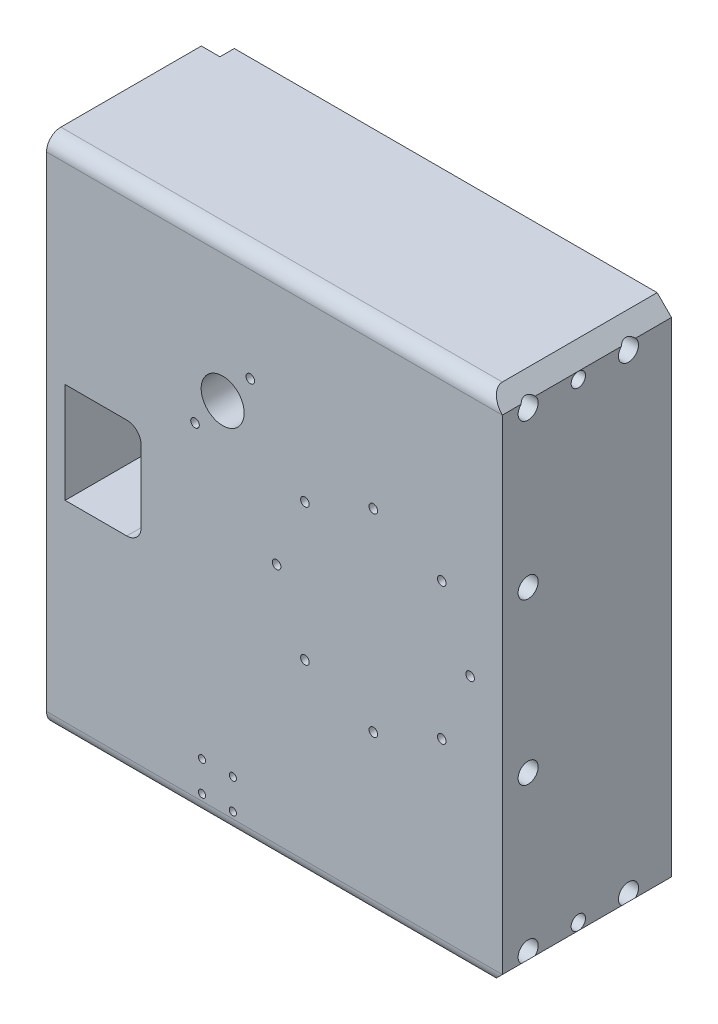
from build123d import *

# Parameters (mm, degrees)
EXTRUDE_1_DEPTH           = 118
SKETCH_3_W                = 13
SKETCH_3_H                = 358
CUT_EXTRUDE_2_DEPTH       = 10
FILLET_1_R                = 10
SKETCH_5_R                = 62
CUT_EXTRUDE_4_DEPTH       = 10
SKETCH_10_R               = 74.5
CUT_EXTRUDE_7_DEPTH       = 6
CUT_EXTRUDE_8_DEPTH       = 494.165286694
CUT_EXTRUDE_8_DEPTH_BACK  = 494.165286694
SKETCH_11_R               = 3
CUT_EXTRUDE_9_DEPTH       = 494.165286694
CUT_EXTRUDE_9_DEPTH_BACK  = 494.165286694
SKETCH_12_R               = 3
CUT_EXTRUDE_10_DEPTH      = 494.165286694
CUT_EXTRUDE_10_DEPTH_BACK = 494.165286694
SKETCH_13_R               = 2.5
CUT_EXTRUDE_11_DEPTH      = 494.165286694
CUT_EXTRUDE_11_DEPTH_BACK = 494.165286694
SKETCH_14_R               = 15
CUT_EXTRUDE_12_DEPTH      = 494.165286694
CUT_EXTRUDE_12_DEPTH_BACK = 494.165286694
CUT_EXTRUDE_14_DEPTH      = 494.165286694
CUT_EXTRUDE_14_DEPTH_BACK = 494.165286694
SKETCH_17_R               = 7
CUT_EXTRUDE_15_DEPTH      = 494.165286782
CUT_EXTRUDE_15_DEPTH_BACK = 494.165286782
SKETCH_18_R               = 5


with BuildPart() as part:
    # ｽｹｯﾁ1 → ﾎﾞｽ - 押し出し1 (new body)
    with BuildSketch(Plane.XY):
        Polygon((0, 0), (308, 0), (318, 10), (318, 348), (308, 358), (0, 358), align=None)
    extrude(amount=EXTRUDE_1_DEPTH)

    # ｽｹｯﾁ3 → ｶｯﾄ - 押し出し2 (cut)
    with BuildSketch(Plane.XY):
        with Locations((6.5, 179)):
            Rectangle(SKETCH_3_W, SKETCH_3_H)
    extrude(amount=CUT_EXTRUDE_2_DEPTH, mode=Mode.SUBTRACT)

    # ﾌｨﾚｯﾄ1
    fillet_1_edges = [part.edges().sort_by_distance(p)[0] for p in [
        (154, 0, 118),
        (154, 358, 118),
    ]]
    fillet(fillet_1_edges, radius=FILLET_1_R)

    # ｽｹｯﾁ5 → ｶｯﾄ - 押し出し4 (cut)
    with BuildSketch(Plane.XY):
        with Locations((228, 179)):
            Circle(SKETCH_5_R)
    extrude(amount=CUT_EXTRUDE_4_DEPTH, mode=Mode.SUBTRACT)

    # ｽｹｯﾁ10 → ｶｯﾄ - 押し出し7 (cut)
    with BuildSketch(Plane.XY.offset(10)):
        with Locations((228, 179)):
            Circle(SKETCH_10_R)
    extrude(amount=CUT_EXTRUDE_7_DEPTH, mode=Mode.SUBTRACT)

    # ｽｹｯﾁ11 → ｶｯﾄ - 押し出し8 (cut, two sides: drawn at the far end of the back side and taken through both)
    with BuildSketch(Plane.XY.offset(-CUT_EXTRUDE_8_DEPTH_BACK)):
        with Locations((295.5, 179)):
            Circle(SKETCH_11_R)
        with Locations((275.72970773, 226.72970773)):
            Circle(SKETCH_11_R)
        with Locations((228, 246.5)):
            Circle(SKETCH_11_R)
        with Locations((180.27029227, 226.72970773)):
            Circle(SKETCH_11_R)
        with Locations((160.5, 179)):
            Circle(SKETCH_11_R)
        with Locations((180.27029227, 131.27029227)):
            Circle(SKETCH_11_R)
        with Locations((228, 111.5)):
            Circle(SKETCH_11_R)
        with Locations((275.72970773, 131.27029227)):
            Circle(SKETCH_11_R)
    extrude(amount=CUT_EXTRUDE_8_DEPTH + CUT_EXTRUDE_8_DEPTH_BACK, mode=Mode.SUBTRACT)

    # ｽｹｯﾁ12 → ｶｯﾄ - 押し出し9 (cut, two sides: drawn at the far end of the back side and taken through both)
    with BuildSketch(Plane.XY.offset(-CUT_EXTRUDE_9_DEPTH_BACK)):
        with Locations((142.17, 282.07)):
            Circle(SKETCH_12_R)
        with Locations((103.6, 236.11)):
            Circle(SKETCH_12_R)
    extrude(amount=CUT_EXTRUDE_9_DEPTH + CUT_EXTRUDE_9_DEPTH_BACK, mode=Mode.SUBTRACT)

    # ｽｹｯﾁ13 → ｶｯﾄ - 押し出し10 (cut, two sides: drawn at the far end of the back side and taken through both)
    with BuildSketch(Plane.XY.offset(-CUT_EXTRUDE_10_DEPTH_BACK)):
        with Locations((108.5, 14.5)):
            Circle(SKETCH_13_R)
        with Locations((108.5, 35.5)):
            Circle(SKETCH_13_R)
        with Locations((130, 14.5)):
            Circle(SKETCH_13_R)
        with Locations((130, 35.5)):
            Circle(SKETCH_13_R)
    extrude(amount=CUT_EXTRUDE_10_DEPTH + CUT_EXTRUDE_10_DEPTH_BACK, mode=Mode.SUBTRACT)

    # ｽｹｯﾁ14 → ｶｯﾄ - 押し出し11 (cut, two sides: drawn at the far end of the back side and taken through both)
    with BuildSketch(Plane.XY.offset(-CUT_EXTRUDE_11_DEPTH_BACK)):
        with Locations((122.89, 259.09)):
            Circle(SKETCH_14_R)
    extrude(amount=CUT_EXTRUDE_11_DEPTH + CUT_EXTRUDE_11_DEPTH_BACK, mode=Mode.SUBTRACT)

    # ｽｹｯﾁ15 → ｶｯﾄ - 押し出し12 (cut, two sides: drawn at the far end of the back side and taken through both)
    with BuildSketch(Plane.XY.offset(-CUT_EXTRUDE_12_DEPTH_BACK)):
        with BuildLine():
            Line((13, 144), (56, 144))
            ThreePointArc((56, 144), (63.071067812, 146.928932188), (66, 154))
            Line((66, 154), (66, 204))
            ThreePointArc((66, 204), (63.071067812, 211.071067812), (56, 214))
            Line((56, 214), (13, 214))
            Line((13, 214), (13, 144))
        make_face()
    extrude(amount=CUT_EXTRUDE_12_DEPTH + CUT_EXTRUDE_12_DEPTH_BACK, mode=Mode.SUBTRACT)

    # ｽｹｯﾁ17 → ｶｯﾄ - 押し出し14 (cut, two sides: drawn at the far end of the back side and taken through both)
    with BuildSketch(Plane(origin=(0, 0, 0), x_dir=(0, 0, -1), z_dir=(1, 0, 0)).offset(-CUT_EXTRUDE_14_DEPTH_BACK)):
        with Locations((-30, 15)):
            Circle(SKETCH_17_R)
        with Locations((-30, 343)):
            Circle(SKETCH_17_R)
        with Locations((-100, 15)):
            Circle(SKETCH_17_R)
        with Locations((-100, 123)):
            Circle(SKETCH_17_R)
        with Locations((-100, 235)):
            Circle(SKETCH_17_R)
        with Locations((-100, 343)):
            Circle(SKETCH_17_R)
    extrude(amount=CUT_EXTRUDE_14_DEPTH + CUT_EXTRUDE_14_DEPTH_BACK, mode=Mode.SUBTRACT)

    # ｽｹｯﾁ18 → ｶｯﾄ - 押し出し15 (cut, two sides: drawn at the far end of the back side and taken through both)
    with BuildSketch(Plane(origin=(0, 0, 0), x_dir=(0, 0, -1), z_dir=(1, 0, 0)).offset(-CUT_EXTRUDE_15_DEPTH_BACK)):
        with Locations((-65, 15)):
            Circle(SKETCH_18_R)
        with Locations((-65, 343)):
            Circle(SKETCH_18_R)
    extrude(amount=CUT_EXTRUDE_15_DEPTH + CUT_EXTRUDE_15_DEPTH_BACK, mode=Mode.SUBTRACT)


solid = part.part
